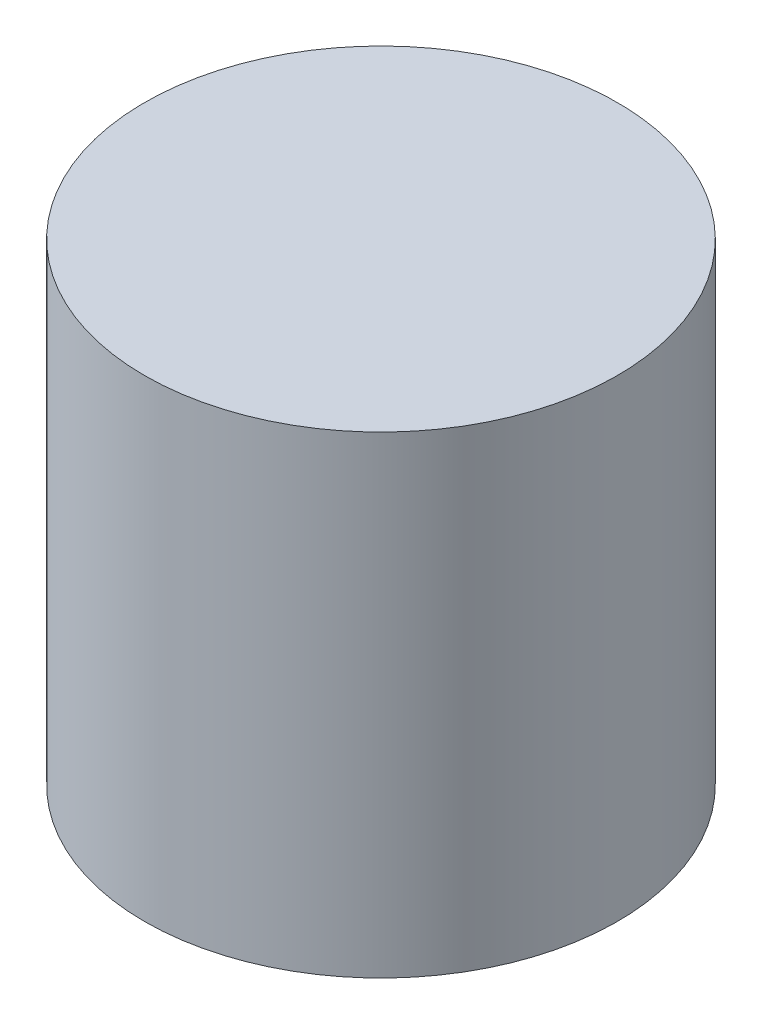
from build123d import *

# Parameters (mm, degrees)
SKETCH2_R           = 1.5
BOSS_EXTRUDE1_DEPTH = 3


with BuildPart() as part:
    # Sketch2 → Boss-Extrude1 (new body)
    with BuildSketch(Plane(origin=(0, 0, 0), x_dir=(1, 0, 0), z_dir=(0, 1, 0))):
        with Locations(Location((0, 0, 0), (0, 0, 270))):
            Circle(SKETCH2_R)
    extrude(amount=BOSS_EXTRUDE1_DEPTH)


solid = part.part
